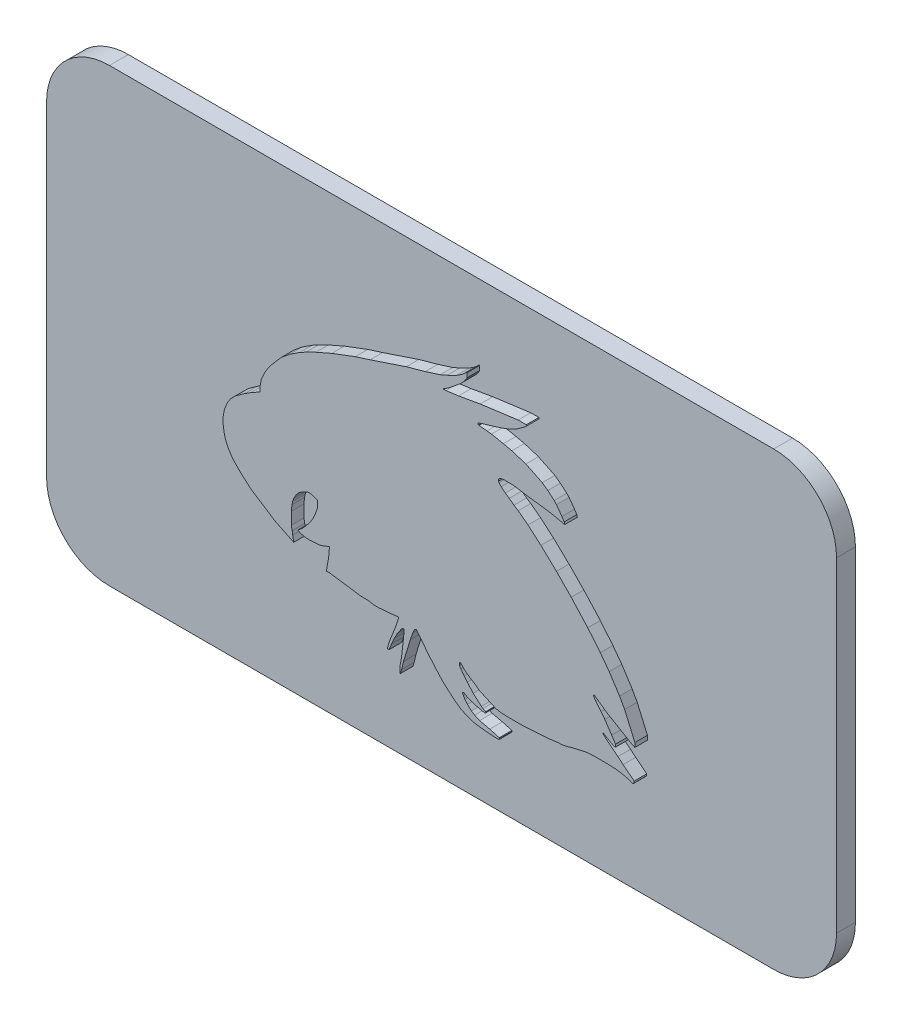
from build123d import *

# Parameters (mm, degrees)
CROQUIS1_W              = 125.65
CROQUIS1_H              = 71.7
SALIENTE_EXTRUIR1_DEPTH = 3
SALIENTE_EXTRUIR2_DEPTH = 2
REDONDEO1_R             = 10


with BuildPart() as part:
    # Croquis1 → Saliente-Extruir1 (new body)
    with BuildSketch(Plane.XY):
        Rectangle(CROQUIS1_W, CROQUIS1_H)
    extrude(amount=SALIENTE_EXTRUIR1_DEPTH)

    # Croquis2 → Saliente-Extruir2 (add)
    with BuildSketch(Plane.XY.offset(3)):
        Polygon((-21.516991039, -13.181266089), (-22.274845829, -12.812579975), (-23.147744139, -12.387926743), (-24.440528918, -11.759004418), (-26.207497708, -10.620945855), (-28.231344216, -9.317439046), (-29.914841407, -7.855800002), (-31.221450822, -6.522119871), (-31.946324079, -5.401861202), (-32.427234626, -4.302536593), (-32.61103965, -3.484604236), (-32.748893418, -2.4552961), (-32.748893418, -1.49266533), (-32.519137138, -0.318327101), (-32.057399529, 0.791362435), (-31.537722476, 1.598221734), (-30.74099228, 2.378780093), (-29.351418568, 3.373649502), (-28.298284088, 4.05508946), (-26.90515628, 4.827138438), (-26.90515628, 5.486263768), (-26.792817235, 6.060454972), (-26.681512287, 6.629360662), (-26.376786856, 7.361704346), (-26.010121682, 8.115404983), (-25.625813049, 8.712089004), (-25.070861238, 9.485736301), (-24.365800802, 10.297815911), (-23.91002416, 10.822773629), (-23.485431628, 11.311813886), (-22.748970852, 11.918009613), (-22.139419736, 12.419743436), (-21.370528222, 12.917261475), (-20.591880117, 13.421092602), (-19.566361005, 13.989418766), (-18.008017711, 14.754891939), (-15.452905758, 15.872651222), (-13.422712571, 16.641296711), (-11.728822477, 17.282615471), (-9.359225797, 18.031371548), (-6.653435499, 18.936390361), (-3.608150413, 19.954961643), (-0.601635484, 20.793319499), (1.773604401, 21.543858742), (2.888701659, 22.031669193), (4.356775771, 22.752801277), (5.233928707, 23.320370824), (5.607353401, 23.627744226), (5.906872415, 23.921183675), (6.000891691, 24.029473877), (6.063255328, 23.975328776), (6.063255328, 23.77446395), (6.063255328, 23.280779597), (5.933670321, 23.014410417), (5.705543107, 22.696382799), (5.376781991, 22.317719943), (4.94485015, 21.894555349), (4.571765958, 21.587462222), (3.822554251, 20.970770947), (3.380201251, 20.606661266), (2.671965323, 20.099597659), (2.33115303, 19.932187392), (2.346175638, 19.820018584), (2.671965323, 19.820018584), (3.187203709, 19.889023725), (3.893087095, 19.983561679), (4.69535925, 20.091008842), (5.705543107, 20.26993387), (8.155453763, 20.703865109), (11.926176339, 21.208872597), (13.210297552, 21.380853116), (13.623423964, 21.436182547), (14.177293986, 21.510361567), (14.449806625, 21.510361567), (15.475580118, 21.510361567), (15.560611316, 21.391595109), (15.256307765, 21.093468238), (14.868184283, 20.815590084), (14.470944, 20.531184728), (14.023779422, 20.211035926), (13.540853823, 19.97381824), (12.465666679, 19.445676002), (11.640350948, 19.133205634), (10.807003839, 18.869880775), (9.665353383, 18.509136803), (8.155453763, 18.067554834), (7.85193363, 17.952639967), (7.796219624, 17.89805683), (7.776292225, 17.796203221), (7.812842278, 17.758895914), (7.870450184, 17.70009447), (7.959046603, 17.65699351), (8.341453859, 17.622058143), (9.236766225, 17.540265588), (9.929876486, 17.450076254), (10.552411547, 17.328278857), (11.07535489, 17.225966325), (11.831477024, 17.078032957), (13.173990073, 16.771906168), (15.40845954, 16.069666682), (16.683183378, 15.449530761), (17.33108744, 15.13433419), (18.009450883, 14.804319542), (18.468858358, 14.474777888), (18.900600004, 14.165081455), (19.379476279, 13.749313455), (19.907110034, 13.291213435), (20.273471607, 12.917261475), (20.695734045, 12.327470717), (21.140350709, 11.70645692), (21.505333937, 11.142391931), (21.598808813, 10.822773629), (21.484761065, 10.822773629), (21.266847144, 10.872463491), (20.783921156, 10.98258278), (20.185559007, 11.119024421), (19.810071187, 11.204645101), (18.468858358, 11.424424426), (17.134515345, 11.598052657), (15.40845954, 11.822651589), (14.342015246, 11.997405663), (13.416860758, 12.149007127), (12.568236945, 12.149007127), (11.831477024, 12.149007127), (11.453415957, 12.098373949), (11.245197772, 11.963644535), (11.027299582, 11.822651589), (11.027299582, 11.511238541), (11.136248677, 11.342862667), (11.48921569, 10.98258278), (12.133286943, 10.423389872), (12.761518367, 10.018762379), (13.522740416, 9.445238072), (14.177293986, 9.023657171), (15.086621471, 8.338546412), (15.744229223, 7.843087785), (16.764951522, 6.956880447), (17.79744294, 6.060454972), (20.273471607, 3.714369481), (22.616476538, 1.322821489), (24.107999448, -0.318327101), (25.247742007, -1.572405655), (27.250460582, -4.005487269), (28.662424039, -5.899544979), (29.547313854, -7.267101966), (30.309910904, -8.445661043), (31.11648353, -9.901085227), (31.575781969, -10.951006214), (32.004771153, -11.931642571), (32.346330872, -12.712421878), (32.748975286, -13.632836112), (32.748975286, -14.30715634), (32.175551012, -14.02819318), (28.299091451, -11.759004418), (26.249101295, -10.288507781), (26.150442735, -10.426045721), (26.235703748, -10.620945855), (26.535986755, -11.0237561), (27.36852254, -12.035195019), (27.956442311, -12.823851389), (29.052593553, -14.451877798), (29.6639776, -15.396744053), (29.6639776, -15.534533848), (29.6639776, -15.81516533), (29.515117843, -15.81516533), (29.288489207, -15.778028577), (29.104868947, -15.646314299), (28.652084248, -15.381264726), (28.075863438, -15.043958541), (27.76269768, -14.860638631), (27.662482425, -14.860638631), (27.662482425, -14.952298586), (27.76269768, -15.02418488), (28.085168853, -15.353337105), (29.252770542, -16.278728802), (30.050018699, -16.91059396), (30.870991277, -17.602487249), (32.635163698, -19.000695668), (32.635163698, -19.139949928), (32.635163698, -19.267974296), (32.574711434, -19.339704506), (32.435355678, -19.429875878), (32.202991828, -19.376891068), (31.707868702, -19.203962112), (31.081621525, -19.025841252), (29.730859454, -18.80449713), (28.363973843, -18.741801624), (26.884417454, -18.741801624), (26.062734007, -18.741801624), (25.091314797, -18.80449713), (24.158385853, -19.014144083), (23.208388562, -19.227626621), (22.709641971, -19.339704506), (22.452690802, -19.414851888), (22.367442145, -19.470012784), (21.313639115, -19.706822453), (20.273471607, -19.773954982), (19.084370148, -19.951960904), (17.410405363, -20.05999878), (16.299711491, -20.131683089), (15.560611316, -20.179384698), (15.01689182, -20.214476415), (13.836052709, -20.214476415), (12.568236945, -20.214476415), (11.48921569, -20.164984503), (10.66980025, -20.030710085), (7.959046603, -18.80449713), (7.354548261, -18.325397321), (6.541572942, -17.822790213), (5.626713307, -17.156956624), (5.152583239, -16.626409647), (5.0144656, -16.47185734), (4.894919946, -16.532086477), (4.809066359, -16.721880528), (4.846436856, -16.971520046), (5.070836907, -17.318320124), (5.575953521, -18.004869108), (6.084143125, -18.650638868), (6.649855499, -19.283665564), (7.028015047, -19.706822453), (7.776292225, -20.359871906), (8.341453859, -20.85310958), (8.584917246, -21.030301899), (8.893934754, -21.19103152), (9.010373388, -21.251594876), (9.054955575, -21.340083721), (9.01198568, -21.422697305), (8.893934754, -21.482173371), (8.739426, -21.456854623), (8.445073528, -21.40862023), (8.083849449, -21.326252041), (7.623642204, -21.221313198), (7.10150635, -21.072804285), (6.520571908, -20.869904479), (6.122333053, -20.689760612), (5.830048323, -20.53773423), (5.607353401, -20.400057171), (5.498611747, -20.375261335), (5.415792129, -20.387659253), (5.364758579, -20.413370824), (5.34648443, -20.493511749), (5.34648443, -20.565340467), (5.390275354, -20.652258775), (5.476916278, -20.824227801), (5.718700862, -21.197894885), (6.122333053, -21.683162167), (6.757597692, -22.281937375), (7.276774493, -22.602908927), (8.058873042, -22.956692228), (8.852718403, -23.137708964), (9.665353383, -23.323010208), (10.30381138, -23.50460414), (10.952653982, -23.689151723), (11.176080069, -23.752699869), (11.231298829, -23.862300689), (11.203689449, -23.959371275), (11.064367026, -24.029564285), (10.899306091, -24.029564285), (10.435232813, -24.029564285), (9.610060303, -23.976130079), (7.940299803, -23.807500279), (7.218072624, -23.689151723), (6.391724839, -23.454117085), (5.070836907, -22.856611703), (3.893087096, -21.999447004), (2.714671283, -20.970999494), (2.029600246, -20.325278755), (1.162637005, -19.355155243), (-0.016913527, -17.980621058), (-1.082160887, -16.626983503), (-1.721022569, -15.81516533), (-2.021335483, -15.465209685), (-2.149110458, -15.465209685), (-2.229894137, -15.534533848), (-2.359920558, -15.713190986), (-2.571532337, -16.180995049), (-2.9636891, -17.30380228), (-3.75261159, -19.862957943), (-4.070817589, -20.895174281), (-4.352608818, -22.130964207), (-4.55262854, -22.779800577), (-4.644863752, -22.779800577), (-4.644863752, -22.698205907), (-4.644863752, -22.455382392), (-4.593482186, -21.661908353), (-4.406796929, -20.689760612), (-4.333023908, -20.097847294), (-4.211713203, -19.025841252), (-4.116635855, -18.185655783), (-4.008499807, -17.114900185), (-3.973183868, -16.569524027), (-3.986530157, -16.480369174), (-4.015984283, -16.379656788), (-4.098883896, -16.354100949), (-4.186266882, -16.379656788), (-4.261804537, -16.444479097), (-4.406796929, -16.568903688), (-4.701106068, -17.044953594), (-5.036791127, -17.506187025), (-5.497740215, -18.392404125), (-5.953020098, -19.398878243), (-6.198801947, -20.005979842), (-6.355810473, -20.393803953), (-6.431704678, -20.393803953), (-6.553311996, -20.393803953), (-6.585714455, -20.30072855), (-6.600809484, -20.199891897), (-6.569513226, -20.122587537), (-6.53670062, -20.016147973), (-6.251955439, -19.092473911), (-5.988072602, -18.440661367), (-5.740937189, -17.809957674), (-5.512506968, -17.245716038), (-5.205256799, -16.430012981), (-4.998858414, -15.760485111), (-4.799542856, -15.113932951), (-5.626722079, -15.237759896), (-7.967191948, -15.437209031), (-8.748083308, -15.437209031), (-9.673638634, -15.259471095), (-10.883660302, -15.259471095), (-12.947996611, -14.952298586), (-14.442107846, -14.729975366), (-15.679769873, -14.545811697), (-16.313096446, -14.545811697), (-16.19942806, -13.781909429), (-15.970909572, -12.59191866), (-15.900449407, -11.759004418), (-15.832097008, -10.951006214), (-16.085168816, -11.0237561), (-16.677861543, -11.286349211), (-17.432901211, -11.503398474), (-18.174711893, -11.566613772), (-18.866100039, -11.599389211), (-19.483776225, -11.599389211), (-20.049578011, -11.490736125), (-20.464860969, -11.368375784), (-20.763495594, -11.238414419), (-20.821563438, -11.152695221), (-20.763495594, -11.064210888), (-20.65599261, -10.991386285), (-20.518321568, -10.898125257), (-20.095242662, -10.5190401), (-19.713575637, -10.097508307), (-19.309602104, -9.614099188), (-18.936124135, -9.134628404), (-18.518782738, -8.498679608), (-18.146523675, -7.716777422), (-17.869808941, -6.957595801), (-17.754940792, -6.567740854), (-17.754940792, -5.480376867), (-18.076539967, -5.385619825), (-18.351625961, -5.285353505), (-18.727453437, -5.148367839), (-19.188071207, -5.148367839), (-19.511588871, -5.216860672), (-20.245237969, -5.60025995), (-20.763495594, -6.003321225), (-21.143499209, -6.458047086), (-21.495629282, -7.108443523), (-21.685291497, -7.62879192), (-21.785919276, -8.133397126), (-21.900571861, -9.096888308), (-21.900571861, -10.097508307), (-21.900571861, -10.708582679), (-21.900571861, -11.027798587), (-21.756590832, -11.70787567), (-21.685291497, -12.258379606), align=None)
    extrude(amount=SALIENTE_EXTRUIR2_DEPTH)

    # Redondeo1
    redondeo1_edges = [part.edges().sort_by_distance(p)[0] for p in [
        (-62.825, 35.85, 1.5),
        (62.825, 35.85, 1.5),
        (62.825, -35.85, 1.5),
        (-62.825, -35.85, 1.5),
    ]]
    fillet(redondeo1_edges, radius=REDONDEO1_R)


solid = part.part
